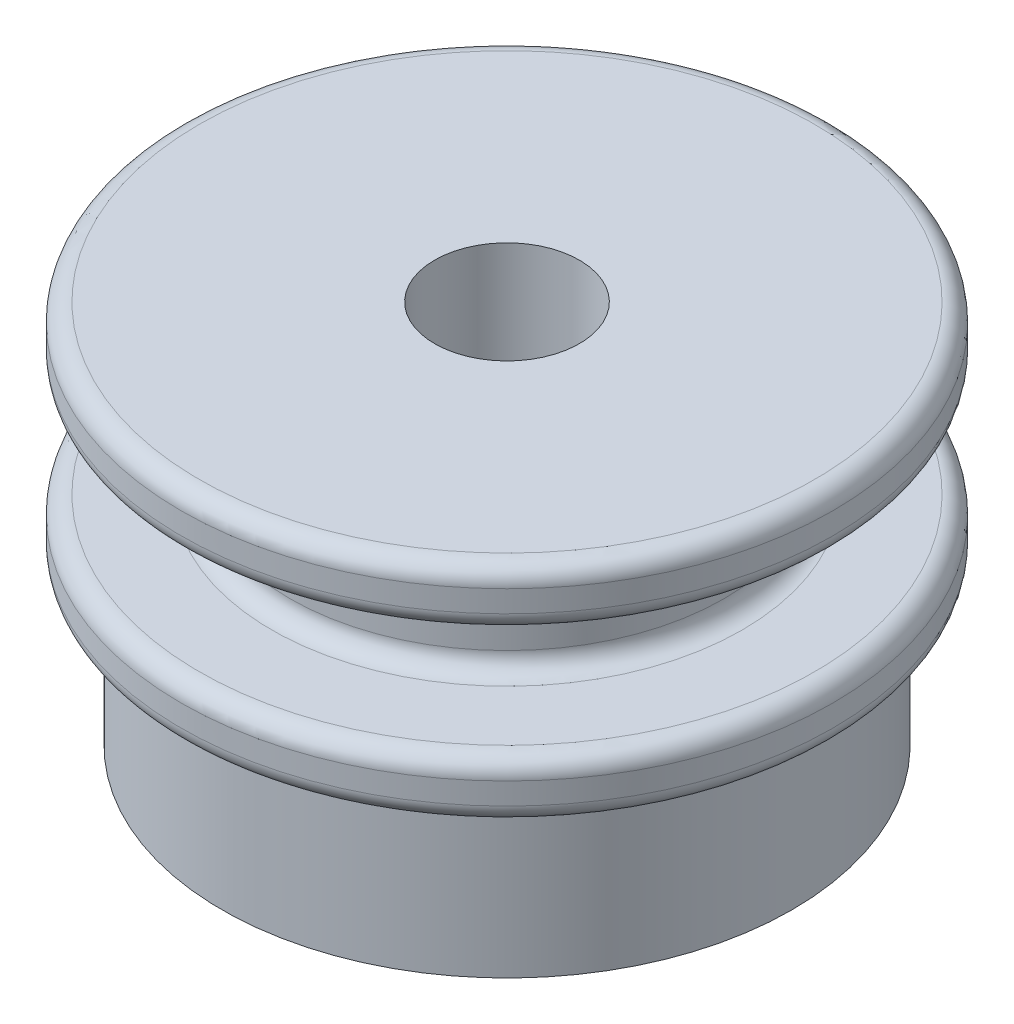
from build123d import *

# Parameters (mm, degrees)
FILLET1_R               = 0.79375
SKETCH3_R               = 3.175
CUT_EXTRUDE1_DEPTH      = 6.35
SKETCH6_R               = 12.5
BOSS_EXTRUDE1_DEPTH     = 7
CUT_EXTRUDE2_DEPTH      = 27.304659694
CUT_EXTRUDE2_DEPTH_BACK = 27.304659694
SKETCH4_R               = 2.0955
SKETCH5_R               = 1.6256
CUT_EXTRUDE3_DEPTH      = 6.35


with BuildPart() as part:
    # Sketch2 → Revolve1 (revolve)
    with BuildSketch(Plane.XY):
        Polygon((0, 4.92125), (14.2875, 4.92125), (14.2875, 2.38125), (9.525, 2.38125), (9.525, -2.38125), (14.2875, -2.38125), (14.2875, -4.92125), (0, -4.92125), align=None)
    revolve(axis=Axis((0, -4.92125, 0), (0, 1, 0)))

    # Fillet1
    fillet1_edges = [part.edges().sort_by_distance(p)[0] for p in [
        (-14.2875, 2.38125, 0),
        (-14.2875, 4.92125, 0),
        (-14.2875, -4.92125, 0),
        (-14.2875, -2.38125, 0),
        (-9.525, -2.38125, 0),
        (-9.525, 2.38125, 0),
    ]]
    fillet(fillet1_edges, radius=FILLET1_R)

    # Sketch3 → Cut-Extrude1 (cut)
    with BuildSketch(Plane(origin=(0, 4.92125, 0), x_dir=(1, 0, 0), z_dir=(0, 1, 0))):
        with Locations(Location((0, 0, 0), (0, 0, 180))):
            Circle(SKETCH3_R)
    extrude(amount=-CUT_EXTRUDE1_DEPTH, mode=Mode.SUBTRACT)

    # Sketch6 → Boss-Extrude1 (add)
    with BuildSketch(Plane.XZ.offset(4.92125)):
        Circle(SKETCH6_R)
    extrude(amount=BOSS_EXTRUDE1_DEPTH)

    # Sketch4 → Cut-Extrude2 (cut, two sides: drawn at the far end of the back side and taken through both)
    with BuildSketch(Plane(origin=(0, -11.92125, 0), x_dir=(1, 0, 0), z_dir=(0, 1, 0)).offset(-CUT_EXTRUDE2_DEPTH_BACK)):
        with Locations(Location((0, 0, 0), (0, 0, 180))):
            Circle(SKETCH4_R)
    extrude(amount=CUT_EXTRUDE2_DEPTH + CUT_EXTRUDE2_DEPTH_BACK, mode=Mode.SUBTRACT)

    # Sketch5 → Cut-Extrude3 (cut)
    with BuildSketch(Plane.XZ.offset(11.92125)):
        with Locations((-6.35, 0)):
            Circle(SKETCH5_R)
        with Locations((6.35, 0)):
            Circle(SKETCH5_R)
    extrude(amount=-CUT_EXTRUDE3_DEPTH, mode=Mode.SUBTRACT)


solid = part.part
